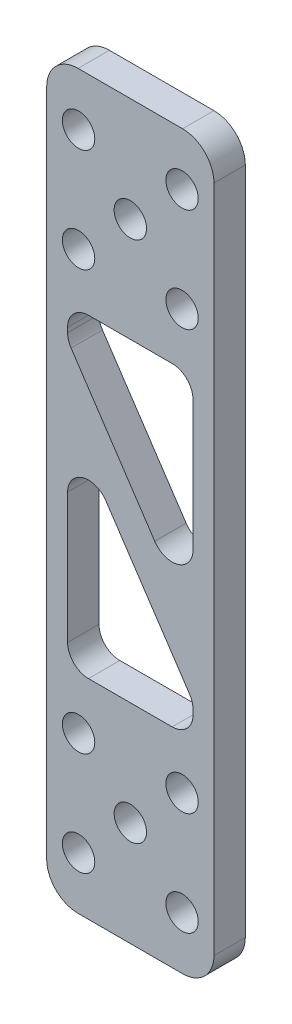
from build123d import *

# Parameters (mm, degrees)
SKETCH_1_R          = 1.55
EXTRUDE_1_DEPTH     = 3
SKETCH_2_W          = 30.67898901
SKETCH_2_H          = 20.291672983
CUT_EXTRUDE_1_DEPTH = 10
SKETCH_3_R          = 1
CUT_EXTRUDE_2_DEPTH = 20
SKETCH_4_W          = 23.960943262
SKETCH_4_H          = 52.328724607
CUT_EXTRUDE_3_DEPTH = 10
FILLET_1_R          = 3
CUT_EXTRUDE_4_DEPTH = 55.457683839
FILLET_2_R          = 2


with BuildPart() as part:
    # 草图1 → 凸台-拉伸1 (new body)
    with BuildSketch(Plane.XY):
        with BuildLine():
            Line((5, 16.216737463), (-5, 16.216737463))
            ThreePointArc((-5, 16.216737463), (-7.121320344, 15.338057806), (-8, 13.216737463))
            Line((-8, 13.216737463), (-8, -66.783262537))
            Line((-8, -66.783262537), (-4, -108.783262537))
            Line((-4, -108.783262537), (4, -108.783262537))
            Line((4, -108.783262537), (8, -66.783262537))
            Line((8, -66.783262537), (8, 13.216737463))
            ThreePointArc((8, 13.216737463), (7.121320344, 15.338057806), (5, 16.216737463))
        make_face()
        with Locations((-4.949747468, 11.166484931)):
            Circle(SKETCH_1_R, mode=Mode.SUBTRACT)
        with Locations((4.949747468, 11.166484931)):
            Circle(SKETCH_1_R, mode=Mode.SUBTRACT)
        with Locations((4.949747468, 1.266989995)):
            Circle(SKETCH_1_R, mode=Mode.SUBTRACT)
        with Locations((-4.949747468, 1.266989995)):
            Circle(SKETCH_1_R, mode=Mode.SUBTRACT)
        with Locations((0, -43.783262537)):
            Circle(SKETCH_1_R, mode=Mode.SUBTRACT)
        with Locations((4.949747468, -38.833515069)):
            Circle(SKETCH_1_R, mode=Mode.SUBTRACT)
        with Locations((-4.949747468, -38.833515069)):
            Circle(SKETCH_1_R, mode=Mode.SUBTRACT)
        with Locations((4.949747468, -48.733010005)):
            Circle(SKETCH_1_R, mode=Mode.SUBTRACT)
        with Locations((-4.949747468, -48.733010005)):
            Circle(SKETCH_1_R, mode=Mode.SUBTRACT)
        with Locations((0, 6.216737463)):
            Circle(SKETCH_1_R, mode=Mode.SUBTRACT)
    extrude(amount=EXTRUDE_1_DEPTH)

    # 草图2 → 切除-拉伸1 (cut)
    with BuildSketch(Plane(origin=(0, 0, 0), x_dir=(-1, 0, 0), z_dir=(0, 0, -1))):
        with Locations((1.230440634, -108.929099029)):
            Rectangle(SKETCH_2_W, SKETCH_2_H)
    extrude(amount=-CUT_EXTRUDE_1_DEPTH, mode=Mode.SUBTRACT)

    # 草图3 → 切除-拉伸2 (cut)
    with BuildSketch(Plane(origin=(0, 0, 0), x_dir=(-1, 0, 0), z_dir=(0, 0, -1))):
        with Locations((0, -83.783262537)):
            Circle(SKETCH_3_R)
        with Locations((0, -90.783262537)):
            Circle(SKETCH_3_R)
        with Locations((0, -73.783262537)):
            Circle(SKETCH_3_R)
    extrude(amount=-CUT_EXTRUDE_2_DEPTH, mode=Mode.SUBTRACT)

    # 草图4 → 切除-拉伸3 (cut)
    with BuildSketch(Plane(origin=(0, 0, 0), x_dir=(-1, 0, 0), z_dir=(0, 0, -1))):
        with Locations((3.980471631, -79.947624841)):
            Rectangle(SKETCH_4_W, SKETCH_4_H)
    extrude(amount=-CUT_EXTRUDE_3_DEPTH, mode=Mode.SUBTRACT)

    # 圆角1
    fillet_1_edges = [part.edges().sort_by_distance(p)[0] for p in [
        (8, -53.783262537, 1.5),
        (-8, -53.783262537, 1.5),
    ]]
    fillet(fillet_1_edges, radius=FILLET_1_R)

    # 草图5 → 切除-拉伸4 (cut, through all)
    with BuildSketch(Plane(origin=(0, 0, 0), x_dir=(-1, 0, 0), z_dir=(0, 0, -1))):
        Polygon((2, -18.783262537), (-6, -30.783262537), (-6, -33.833515069), (6, -33.833515069), (6, -18.783262537), align=None)
        Polygon((6, -3.733010005), (-6, -3.733010005), (-6, -18.783262537), (-2, -18.783262537), (6, -6.783262537), align=None)
        Polygon((-2, -18.783262537), (-6, -18.783262537), (-6, -24.783262537), align=None)
        Polygon((6, -18.783262537), (6, -12.783262537), (2, -18.783262537), align=None)
    extrude(amount=-CUT_EXTRUDE_4_DEPTH, mode=Mode.SUBTRACT)

    # 圆角2
    fillet_2_edges = [part.edges().sort_by_distance(p)[0] for p in [
        (-6, -12.783262537, 1.5),
        (-6, -33.833515069, 1.5),
        (6, -33.833515069, 1.5),
        (6, -30.783262537, 1.5),
        (6, -24.783262537, 1.5),
        (6, -3.733010005, 1.5),
        (-6, -3.733010005, 1.5),
        (-6, -6.783262537, 1.5),
    ]]
    fillet(fillet_2_edges, radius=FILLET_2_R)


solid = part.part
